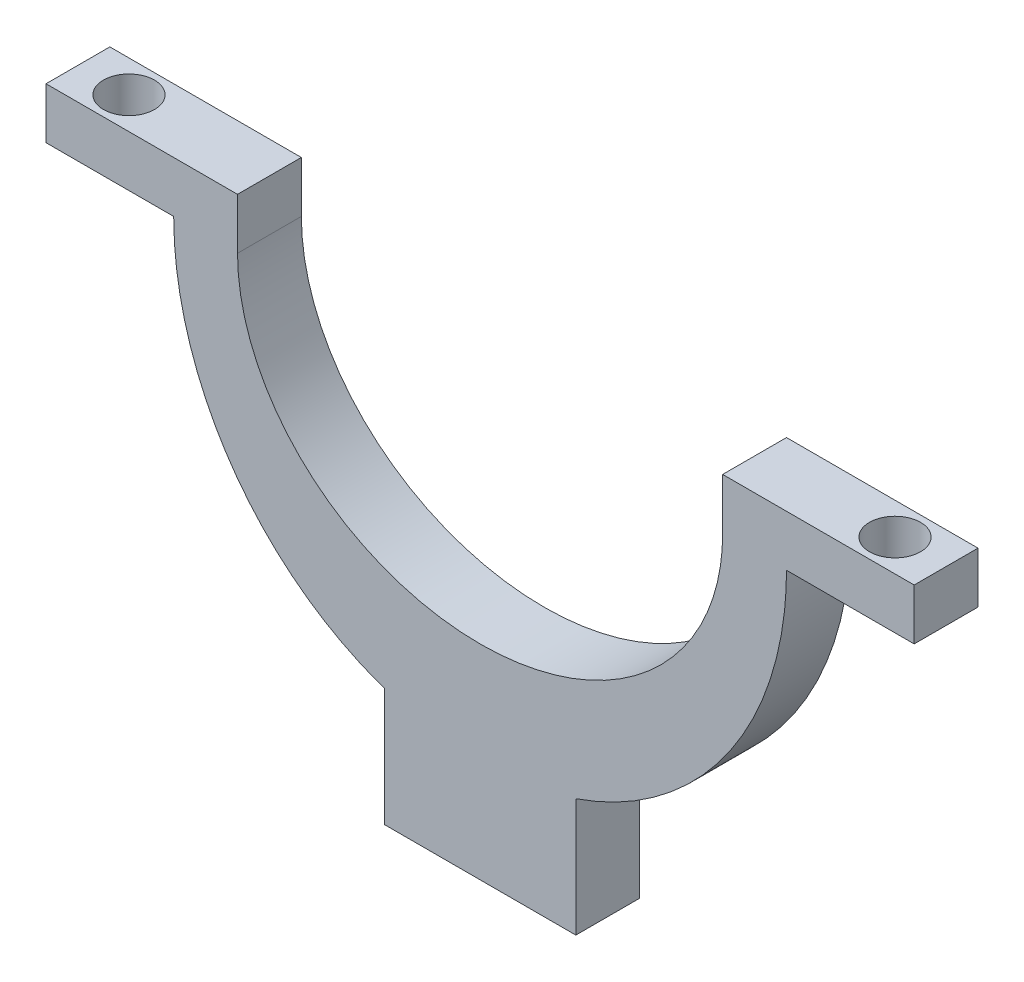
from build123d import *

# Parameters (mm, degrees)
BOSS_EXTRUDE1_DEPTH = 5
SKETCH3_W           = 15
SKETCH3_H           = 5
BOSS_EXTRUDE2_DEPTH = 4
SKETCH4_R           = 2
CUT_EXTRUDE1_DEPTH  = 45.966654463
SKETCH5_W           = 15
SKETCH5_H           = 5
BOSS_EXTRUDE3_DEPTH = 10


with BuildPart() as part:
    # Sketch2 → Boss-Extrude1 (new body)
    with BuildSketch(Plane.XY):
        with BuildLine():
            Line((-19, 0), (-24, 0))
            add(Edge.make_bspline(
                [(-24, 0), (-24, -25), (0, -25)],
                knots=[4.71238898, 4.71238898, 4.71238898, 6.283185307, 6.283185307, 6.283185307], degree=2, weights=[1, 0.707106781, 1]))
            add(Edge.make_bspline(
                [(0, -25), (24, -25), (24, 0)],
                knots=[0, 0, 0, 1.570796327, 1.570796327, 1.570796327], degree=2, weights=[1, 0.707106781, 1]))
            Line((24, 0), (19, 0))
            add(Edge.make_bspline(
                [(-19, 0), (-19, -17), (0, -17), (19, -17), (19, 0)],
                knots=[0, 0, 0, 1.570796327, 1.570796327, 3.141592654, 3.141592654, 3.141592654], degree=2, weights=[1, 0.707106781, 1, 0.707106781, 1]))
        make_face()
    extrude(amount=BOSS_EXTRUDE1_DEPTH)

    # Sketch3 → Boss-Extrude2 (add)
    with BuildSketch(Plane(origin=(0, 0, 0), x_dir=(1, 0, 0), z_dir=(0, 1, 0))):
        with Locations((-26.5, -2.5)):
            Rectangle(SKETCH3_W, SKETCH3_H)
        with Locations((26.5, -2.5)):
            Rectangle(SKETCH3_W, SKETCH3_H)
    extrude(amount=BOSS_EXTRUDE2_DEPTH)

    # Sketch4 → Cut-Extrude1 (cut, through all)
    with BuildSketch(Plane(origin=(0, 4, 0), x_dir=(1, 0, 0), z_dir=(0, 1, 0))):
        with Locations(Location((-30, -2.5, 0), (0, 0, 270))):
            Circle(SKETCH4_R)
        with Locations(Location((30, -2.5, 0), (0, 0, 270))):
            Circle(SKETCH4_R)
    extrude(amount=-CUT_EXTRUDE1_DEPTH, mode=Mode.SUBTRACT)

    # Sketch5 → Boss-Extrude3 (add)
    with BuildSketch(Plane(origin=(0, -23, 0), x_dir=(1, 0, 0), z_dir=(0, 1, 0))):
        with Locations((0, -2.5)):
            Rectangle(SKETCH5_W, SKETCH5_H)
    extrude(amount=-BOSS_EXTRUDE3_DEPTH)


solid = part.part
